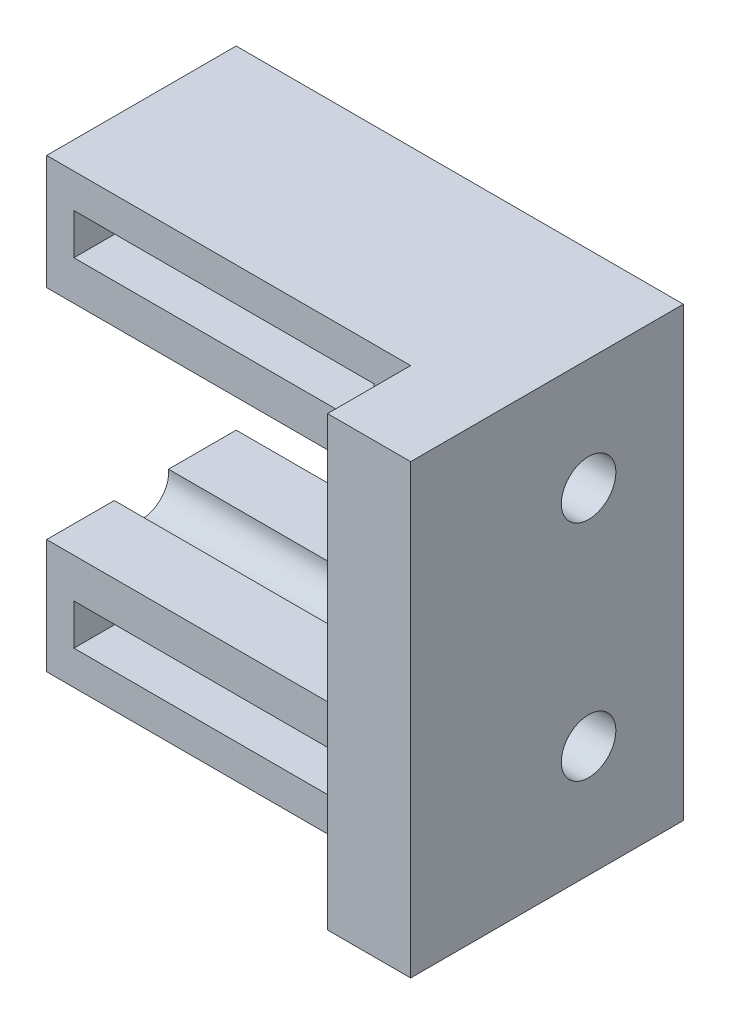
from build123d import *

# Parameters (mm, degrees)
SKETCH1_W           = 22
SKETCH1_H           = 3
BOSS_EXTRUDE1_DEPTH = 13.9
SKETCH1_3_W         = 6.1
SKETCH1_3_H         = 32.8
BOSS_EXTRUDE2_DEPTH = 20
SKETCH2_R           = 2
CUT_EXTRUDE1_DEPTH  = 42.7708032


with BuildPart() as part:
    # Sketch1 → Boss-Extrude1 (new body)
    with BuildSketch(Plane.XY):
        Polygon((-16.4, -8), (-16.4, -16.4), (10.3, -16.4), (10.3, 16.4), (-16.4, 16.4), (-16.4, 8), (7.6, 8), (7.6, -8), align=None)
        with Locations((-3.4, -12.4)):
            Rectangle(SKETCH1_W, SKETCH1_H, mode=Mode.SUBTRACT)
        with Locations((-3.4, 12.4)):
            Rectangle(SKETCH1_W, SKETCH1_H, mode=Mode.SUBTRACT)
    extrude(amount=BOSS_EXTRUDE1_DEPTH)

    # Sketch1<3> → Boss-Extrude2 (add)
    with BuildSketch(Plane.XY):
        with Locations((13.35, 0)):
            Rectangle(SKETCH1_3_W, SKETCH1_3_H)
    extrude(amount=BOSS_EXTRUDE2_DEPTH)

    # Sketch2 → Cut-Extrude1 (cut, through all)
    with BuildSketch(Plane(origin=(16.4, 0, 0), x_dir=(0, 0, -1), z_dir=(1, 0, 0))):
        with Locations((-6.95, 8.2)):
            Circle(SKETCH2_R)
        with Locations((-6.95, -8.2)):
            Circle(SKETCH2_R)
    extrude(amount=-CUT_EXTRUDE1_DEPTH, mode=Mode.SUBTRACT)


solid = part.part
